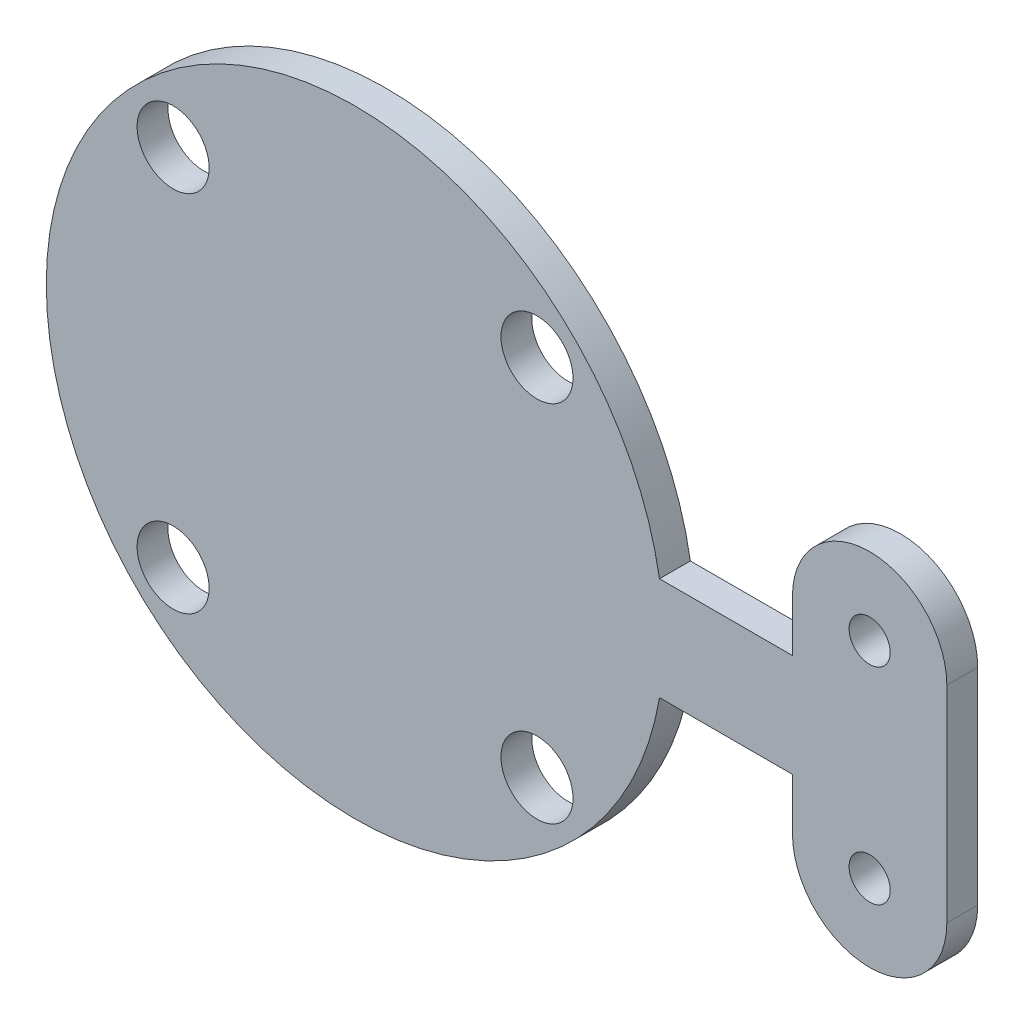
from build123d import *

# Parameters (mm, degrees)
SKETCH_2_R          = 30
EXTRUDE_1_DEPTH     = 3
SKETCH_3_R          = 3.5
CUT_EXTRUDE_1_DEPTH = 3
SKETCH_4_W          = 3
SKETCH_4_H          = 10
EXTRUDE_2_DEPTH     = 50
EXTRUDE_3_DEPTH     = 3
SKETCH_7_R          = 2
CUT_EXTRUDE_2_DEPTH = 3


with BuildPart() as part:
    # 草图2 → 凸台-拉伸1 (new body)
    with BuildSketch(Plane.XY):
        Circle(SKETCH_2_R)
    extrude(amount=EXTRUDE_1_DEPTH)

    # 草图3 → 切除-拉伸1 (cut)
    with BuildSketch(Plane.XY.offset(3)):
        with Locations((-17.67766953, 17.67766953)):
            Circle(SKETCH_3_R)
        with Locations(Location((17.67766953, 17.67766953, 0), (0, 0, 180))):
            Circle(SKETCH_3_R)
        with Locations((17.67766953, -17.67766953)):
            Circle(SKETCH_3_R)
        with Locations(Location((-17.67766953, -17.67766953, 0), (0, 0, 180))):
            Circle(SKETCH_3_R)
    extrude(amount=-CUT_EXTRUDE_1_DEPTH, mode=Mode.SUBTRACT)

    # 草图4 → 凸台-拉伸2 (add)
    with BuildSketch(Plane(origin=(0, 0, 0), x_dir=(0, 0, -1), z_dir=(1, 0, 0))):
        with Locations((-1.5, 0)):
            Rectangle(SKETCH_4_W, SKETCH_4_H)
    extrude(amount=EXTRUDE_2_DEPTH)

    # 草图5 → 凸台-拉伸3 (add)
    with BuildSketch(Plane.XY.offset(3)):
        with BuildLine():
            Line((57.5, 10), (57.5, -10))
            ThreePointArc((57.5, -10), (50, -17.5), (42.5, -10))
            Line((42.5, -10), (42.5, 10))
            ThreePointArc((42.5, 10), (50, 17.5), (57.5, 10))
        make_face()
    extrude(amount=-EXTRUDE_3_DEPTH)

    # 草图7 → 切除-拉伸2 (cut)
    with BuildSketch(Plane.XY.offset(3)):
        with Locations((50, 10)):
            Circle(SKETCH_7_R)
        with Locations((50, -10)):
            Circle(SKETCH_7_R)
    extrude(amount=-CUT_EXTRUDE_2_DEPTH, mode=Mode.SUBTRACT)


solid = part.part
